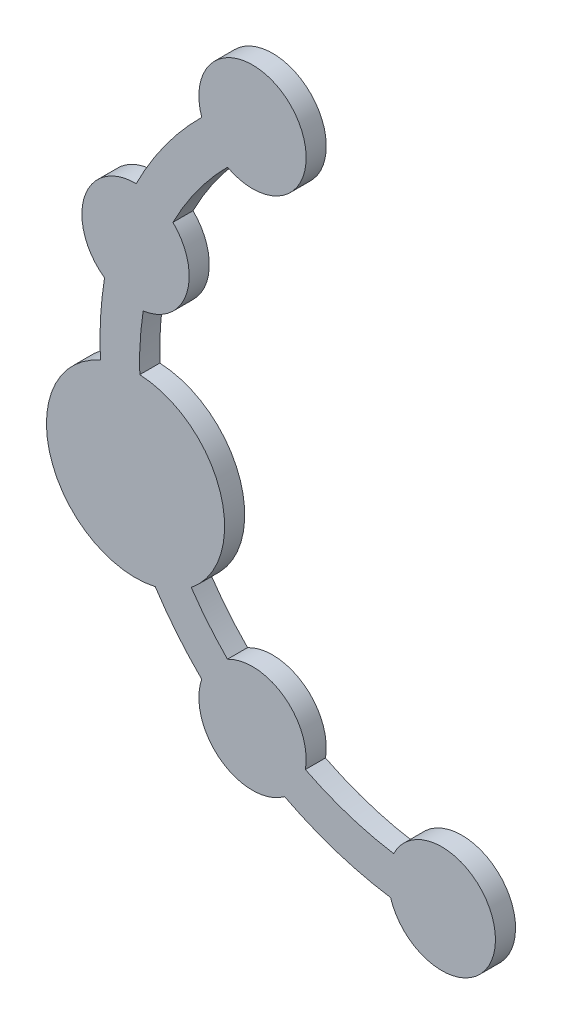
from build123d import *

# Parameters (mm, degrees)
SKETCH1_R             = 5.42
BOSS_EXTRUDE1_DEPTH   = 2.03
BOSS_EXTRUDE1_2_DEPTH = 2.03
BOSS_EXTRUDE1_3_DEPTH = 2.03
BOSS_EXTRUDE1_4_DEPTH = 2.03
BOSS_EXTRUDE1_5_DEPTH = 2.03
BOSS_EXTRUDE2_DEPTH   = 2.03
SKETCH3_R             = 9
BOSS_EXTRUDE3_DEPTH   = 2.03


with BuildPart() as part:
    # Sketch1 → Boss-Extrude1 (new body)
    with BuildSketch(Plane.XY):
        with Locations((0, -32.53)):
            Circle(SKETCH1_R)
    extrude(amount=BOSS_EXTRUDE1_DEPTH)



with BuildPart() as body_2:
    # Sketch1 → Boss-Extrude1 2 (new body)
    with BuildSketch(Plane.XY):
        with Locations((-19.120654257, -26.317322827)):
            Circle(SKETCH1_R)
    extrude(amount=BOSS_EXTRUDE1_2_DEPTH)


with BuildPart() as body_3:
    # Sketch1 → Boss-Extrude1 3 (new body)
    with BuildSketch(Plane.XY):
        with Locations((-30.937868475, -10.052322827)):
            Circle(SKETCH1_R)
    extrude(amount=BOSS_EXTRUDE1_3_DEPTH)


with BuildPart() as body_4:
    # Sketch1 → Boss-Extrude1 4 (new body)
    with BuildSketch(Plane.XY):
        with Locations((-30.937868475, 10.052322827)):
            Circle(SKETCH1_R)
    extrude(amount=BOSS_EXTRUDE1_4_DEPTH)


with BuildPart() as body_5:
    # Sketch1 → Boss-Extrude1 5 (new body)
    with BuildSketch(Plane.XY):
        with Locations((-19.120654257, 26.317322827)):
            Circle(SKETCH1_R)
    extrude(amount=BOSS_EXTRUDE1_5_DEPTH)


with BuildPart() as part_1:
    add(part.part)

    add(body_2.part)  # Boss-Extrude2 merges body 2

    add(body_3.part)  # Boss-Extrude2 merges body 3

    add(body_4.part)  # Boss-Extrude2 merges body 4

    add(body_5.part)  # Boss-Extrude2 merges body 5
    # Sketch2 → Boss-Extrude2 (add)
    with BuildSketch(Plane.XY.offset(2.03)):
        with BuildLine():
            Line((-20.296224762, 27.935356816), (-17.945083752, 24.699288838))
            ThreePointArc((-17.945083752, 24.699288838), (-29.035755442, -9.434288838), (0, -30.53))
            Line((0, -30.53), (0, -34.53))
            ThreePointArc((0, -34.53), (-32.839981508, -10.670356816), (-20.296224762, 27.935356816))
        make_face()
    extrude(amount=-BOSS_EXTRUDE2_DEPTH)

    # Sketch3 → Boss-Extrude3 (add)
    with BuildSketch(Plane.XY.offset(2.03)):
        with Locations((-30.937868475, -10.052322827)):
            Circle(SKETCH3_R)
    extrude(amount=-BOSS_EXTRUDE3_DEPTH)


solid = part_1.part
